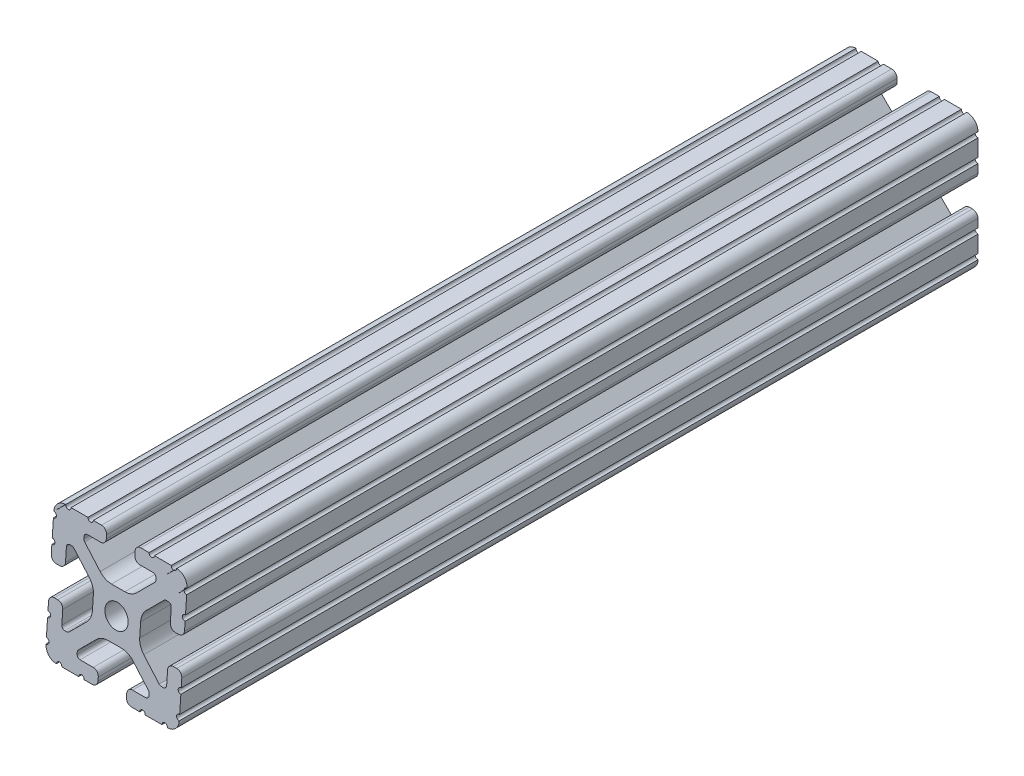
from build123d import *

# Parameters (mm, degrees)
SKETCH1_R          = 3.3274
EXTRUDE1_DEPTH     = 228.6
CUT_EXTRUDE1_DEPTH = 127


with BuildPart() as part:
    # Sketch1 → Extrude1 (new body)
    with BuildSketch(Plane.XY):
        with BuildLine():
            Line((-10.022898969, 12.91475973), (-5.252158105, 8.144007132))
            ThreePointArc((-5.252158105, 8.144007132), (-3.715177372, 7.117027388), (-1.902183975, 6.7564))
            Line((-1.902183975, 6.7564), (1.902183975, 6.7564))
            ThreePointArc((1.902183975, 6.7564), (3.715177372, 7.117027388), (5.252158105, 8.144007132))
            Line((5.252158105, 8.144007132), (10.022898969, 12.91475973))
            ThreePointArc((10.022898969, 12.91475973), (10.218362387, 13.207291992), (10.287, 13.552357131))
            Line((10.287, 13.552357131), (10.287, 14.0843))
            ThreePointArc((10.287, 14.0843), (10.022898185, 14.721898185), (9.3853, 14.986))
            Line((9.3853, 14.986), (5.617617549, 14.986))
            ThreePointArc((5.617617549, 14.986), (4.519044045, 15.441044045), (4.064, 16.539617549))
            Line((4.064, 16.539617549), (4.064, 17.496382451))
            ThreePointArc((4.064, 17.496382451), (4.519044045, 18.594955955), (5.617617549, 19.05))
            Line((5.617617549, 19.05), (7.974178704, 19.05))
            ThreePointArc((7.974178704, 19.05), (8.736178704, 18.288), (9.498178704, 19.05))
            Line((9.498178704, 19.05), (14.327719207, 19.05))
            ThreePointArc((14.327719207, 19.05), (15.087603123, 18.231251131), (15.847487039, 19.05))
            ThreePointArc((15.847487039, 19.05), (18.120176289, 18.120192083), (19.05, 15.847509295))
            ThreePointArc((19.05, 15.847509295), (18.231250992, 15.08762539), (19.05, 14.327741484))
            Line((19.05, 14.327741484), (19.05, 9.496091471))
            ThreePointArc((19.05, 9.496091471), (18.231250992, 8.736207565), (19.05, 7.97632366))
            Line((19.05, 7.97632366), (19.05, 5.617617549))
            ThreePointArc((19.05, 5.617617549), (18.594955955, 4.519044045), (17.496382451, 4.064))
            Line((17.496382451, 4.064), (16.539617549, 4.064))
            ThreePointArc((16.539617549, 4.064), (15.441044045, 4.519044045), (14.986, 5.617617549))
            Line((14.986, 5.617617549), (14.986, 9.385342516))
            ThreePointArc((14.986, 9.385342516), (14.721898185, 10.022940701), (14.0843, 10.287042516))
            Line((14.0843, 10.287042516), (13.516042086, 10.287042516))
            ThreePointArc((13.516042086, 10.287042516), (13.170975923, 10.218404478), (12.878443117, 10.022939917))
            Line((12.878443117, 10.022939917), (8.14758008, 5.292065243))
            ThreePointArc((8.14758008, 5.292065243), (7.117955879, 3.751120653), (6.7564, 1.933453584))
            Line((6.7564, 1.933453584), (6.7564, -1.933453584))
            ThreePointArc((6.7564, -1.933453584), (7.117955879, -3.751120653), (8.14758008, -5.292065243))
            Line((8.14758008, -5.292065243), (12.878443117, -10.022939917))
            ThreePointArc((12.878443117, -10.022939917), (13.170975923, -10.218404478), (13.516042086, -10.287042516))
            Line((13.516042086, -10.287042516), (14.0843, -10.287042516))
            ThreePointArc((14.0843, -10.287042516), (14.721898185, -10.022940701), (14.986, -9.385342516))
            Line((14.986, -9.385342516), (14.986, -5.617617549))
            ThreePointArc((14.986, -5.617617549), (15.441044045, -4.519044045), (16.539617549, -4.064))
            Line((16.539617549, -4.064), (17.496382451, -4.064))
            ThreePointArc((17.496382451, -4.064), (18.594955955, -4.519044045), (19.05, -5.617617549))
            Line((19.05, -5.617617549), (19.05, -7.976318491))
            ThreePointArc((19.05, -7.976318491), (18.231250992, -8.736202396), (19.05, -9.496086302))
            Line((19.05, -9.496086302), (19.05, -14.32774291))
            ThreePointArc((19.05, -14.32774291), (18.231250992, -15.087626816), (19.05, -15.847510721))
            ThreePointArc((19.05, -15.847510721), (18.120175716, -18.120192644), (15.847486868, -19.05))
            ThreePointArc((15.847486868, -19.05), (15.087602952, -18.231251131), (14.327719036, -19.05))
            Line((14.327719036, -19.05), (9.496062448, -19.05))
            ThreePointArc((9.496062448, -19.05), (8.736178532, -18.231251131), (7.976294616, -19.05))
            Line((7.976294616, -19.05), (5.617617549, -19.05))
            ThreePointArc((5.617617549, -19.05), (4.519044045, -18.594955955), (4.064, -17.496382451))
            Line((4.064, -17.496382451), (4.064, -16.539617549))
            ThreePointArc((4.064, -16.539617549), (4.519044045, -15.441044045), (5.617617549, -14.986))
            Line((5.617617549, -14.986), (9.3853, -14.986))
            ThreePointArc((9.3853, -14.986), (10.022898185, -14.721898185), (10.287, -14.0843))
            Line((10.287, -14.0843), (10.287, -13.552357131))
            ThreePointArc((10.287, -13.552357131), (10.218362387, -13.207291992), (10.022898969, -12.91475973))
            Line((10.022898969, -12.91475973), (5.252158105, -8.144007132))
            ThreePointArc((5.252158105, -8.144007132), (3.715177372, -7.117027388), (1.902183975, -6.7564))
            Line((1.902183975, -6.7564), (-1.902183975, -6.7564))
            ThreePointArc((-1.902183975, -6.7564), (-3.715177372, -7.117027388), (-5.252158105, -8.144007132))
            Line((-5.252158105, -8.144007132), (-10.022898969, -12.91475973))
            ThreePointArc((-10.022898969, -12.91475973), (-10.218362387, -13.207291992), (-10.287, -13.552357131))
            Line((-10.287, -13.552357131), (-10.287, -14.0843))
            ThreePointArc((-10.287, -14.0843), (-10.022898185, -14.721898185), (-9.3853, -14.986))
            Line((-9.3853, -14.986), (-5.617617549, -14.986))
            ThreePointArc((-5.617617549, -14.986), (-4.519044045, -15.441044045), (-4.064, -16.539617549))
            Line((-4.064, -16.539617549), (-4.064, -17.496382451))
            ThreePointArc((-4.064, -17.496382451), (-4.519044045, -18.594955955), (-5.617617549, -19.05))
            Line((-5.617617549, -19.05), (-7.976294616, -19.05))
            ThreePointArc((-7.976294616, -19.05), (-8.736178532, -18.231251131), (-9.496062448, -19.05))
            Line((-9.496062448, -19.05), (-14.327719036, -19.05))
            ThreePointArc((-14.327719036, -19.05), (-15.087602952, -18.231251131), (-15.847486868, -19.05))
            ThreePointArc((-15.847486868, -19.05), (-18.120175716, -18.120192644), (-19.05, -15.847510721))
            ThreePointArc((-19.05, -15.847510721), (-18.231250992, -15.087626816), (-19.05, -14.32774291))
            Line((-19.05, -14.32774291), (-19.05, -9.496086302))
            ThreePointArc((-19.05, -9.496086302), (-18.231250992, -8.736202396), (-19.05, -7.976318491))
            Line((-19.05, -7.976318491), (-19.05, -5.617617549))
            ThreePointArc((-19.05, -5.617617549), (-18.594955955, -4.519044045), (-17.496382451, -4.064))
            Line((-17.496382451, -4.064), (-16.539617549, -4.064))
            ThreePointArc((-16.539617549, -4.064), (-15.441044045, -4.519044045), (-14.986, -5.617617549))
            Line((-14.986, -5.617617549), (-14.986, -9.385342516))
            ThreePointArc((-14.986, -9.385342516), (-14.721898185, -10.022940701), (-14.0843, -10.287042516))
            Line((-14.0843, -10.287042516), (-13.516042086, -10.287042516))
            ThreePointArc((-13.516042086, -10.287042516), (-13.170975923, -10.218404478), (-12.878443117, -10.022939917))
            Line((-12.878443117, -10.022939917), (-8.14758008, -5.292065243))
            ThreePointArc((-8.14758008, -5.292065243), (-7.117955879, -3.751120653), (-6.7564, -1.933453584))
            Line((-6.7564, -1.933453584), (-6.7564, 1.933453584))
            ThreePointArc((-6.7564, 1.933453584), (-7.117955879, 3.751120653), (-8.14758008, 5.292065243))
            Line((-8.14758008, 5.292065243), (-12.878443117, 10.022939917))
            ThreePointArc((-12.878443117, 10.022939917), (-13.170975923, 10.218404478), (-13.516042086, 10.287042516))
            Line((-13.516042086, 10.287042516), (-14.0843, 10.287042516))
            ThreePointArc((-14.0843, 10.287042516), (-14.721898185, 10.022940701), (-14.986, 9.385342516))
            Line((-14.986, 9.385342516), (-14.986, 5.617617549))
            ThreePointArc((-14.986, 5.617617549), (-15.441044045, 4.519044045), (-16.539617549, 4.064))
            Line((-16.539617549, 4.064), (-17.496382451, 4.064))
            ThreePointArc((-17.496382451, 4.064), (-18.594955955, 4.519044045), (-19.05, 5.617617549))
            Line((-19.05, 5.617617549), (-19.05, 7.97632366))
            ThreePointArc((-19.05, 7.97632366), (-18.231250992, 8.736207565), (-19.05, 9.496091471))
            Line((-19.05, 9.496091471), (-19.05, 14.327741484))
            ThreePointArc((-19.05, 14.327741484), (-18.231250992, 15.08762539), (-19.05, 15.847509295))
            ThreePointArc((-19.05, 15.847509295), (-18.120176289, 18.120192083), (-15.847487039, 19.05))
            ThreePointArc((-15.847487039, 19.05), (-15.087603123, 18.231251131), (-14.327719207, 19.05))
            Line((-14.327719207, 19.05), (-9.498178704, 19.05))
            ThreePointArc((-9.498178704, 19.05), (-8.736178704, 18.288), (-7.974178704, 19.05))
            Line((-7.974178704, 19.05), (-5.617617549, 19.05))
            ThreePointArc((-5.617617549, 19.05), (-4.519044045, 18.594955955), (-4.064, 17.496382451))
            Line((-4.064, 17.496382451), (-4.064, 16.539617549))
            ThreePointArc((-4.064, 16.539617549), (-4.519044045, 15.441044045), (-5.617617549, 14.986))
            Line((-5.617617549, 14.986), (-9.3853, 14.986))
            ThreePointArc((-9.3853, 14.986), (-10.022898185, 14.721898185), (-10.287, 14.0843))
            Line((-10.287, 14.0843), (-10.287, 13.552357131))
            ThreePointArc((-10.287, 13.552357131), (-10.218362387, 13.207291992), (-10.022898969, 12.91475973))
        make_face()
        Circle(SKETCH1_R, mode=Mode.SUBTRACT)
    extrude(amount=-EXTRUDE1_DEPTH)

    # Sketch2 → Cut-Extrude1 (cut)
    with BuildSketch(Plane(origin=(19.05, 0, 0), x_dir=(0, 0, -1), z_dir=(1, 0, 0))):
        Polygon((0, -19.05), (0, 19.05), (2.664211535, 19.05), align=None)
    extrude(amount=-CUT_EXTRUDE1_DEPTH, mode=Mode.SUBTRACT)


solid = part.part
